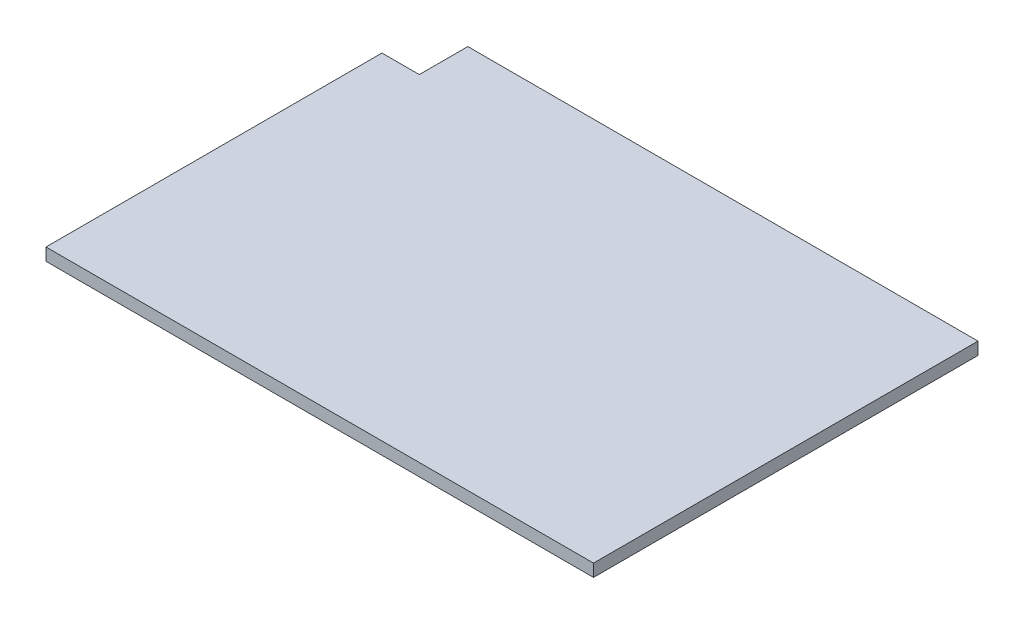
from build123d import *

# Parameters (mm, degrees)
BOSS_EXTRUDE1_DEPTH = 10


with BuildPart() as part:
    # Sketch1 → Boss-Extrude1 (new body)
    with BuildSketch(Plane(origin=(0, 0, 0), x_dir=(1, 0, 0), z_dir=(0, 1, 0))):
        Polygon((0, 0), (440, 0), (440, 309), (30, 309), (30, 270), (0, 270), align=None)
    extrude(amount=BOSS_EXTRUDE1_DEPTH)


solid = part.part
